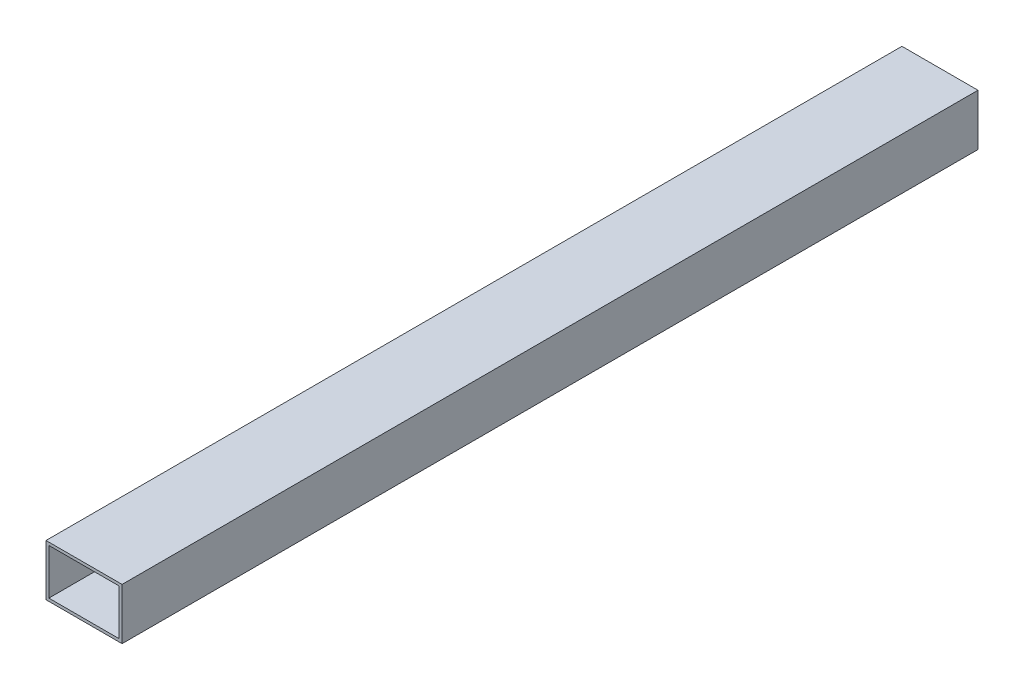
from build123d import *

# Parameters (mm, degrees)
ESQUISSE1_W        = 40
ESQUISSE1_H        = 27
ESQUISSE1_W_2      = 37
ESQUISSE1_H_2      = 24
BOSS_EXTRU_1_DEPTH = 450


with BuildPart() as part:
    # Esquisse1 → Boss.-Extru.1 (new body)
    with BuildSketch(Plane.XY):
        with Locations((20, 13.5)):
            Rectangle(ESQUISSE1_W, ESQUISSE1_H)
        with Locations((20, 13.5)):
            Rectangle(ESQUISSE1_W_2, ESQUISSE1_H_2, mode=Mode.SUBTRACT)
    extrude(amount=BOSS_EXTRU_1_DEPTH)


solid = part.part
